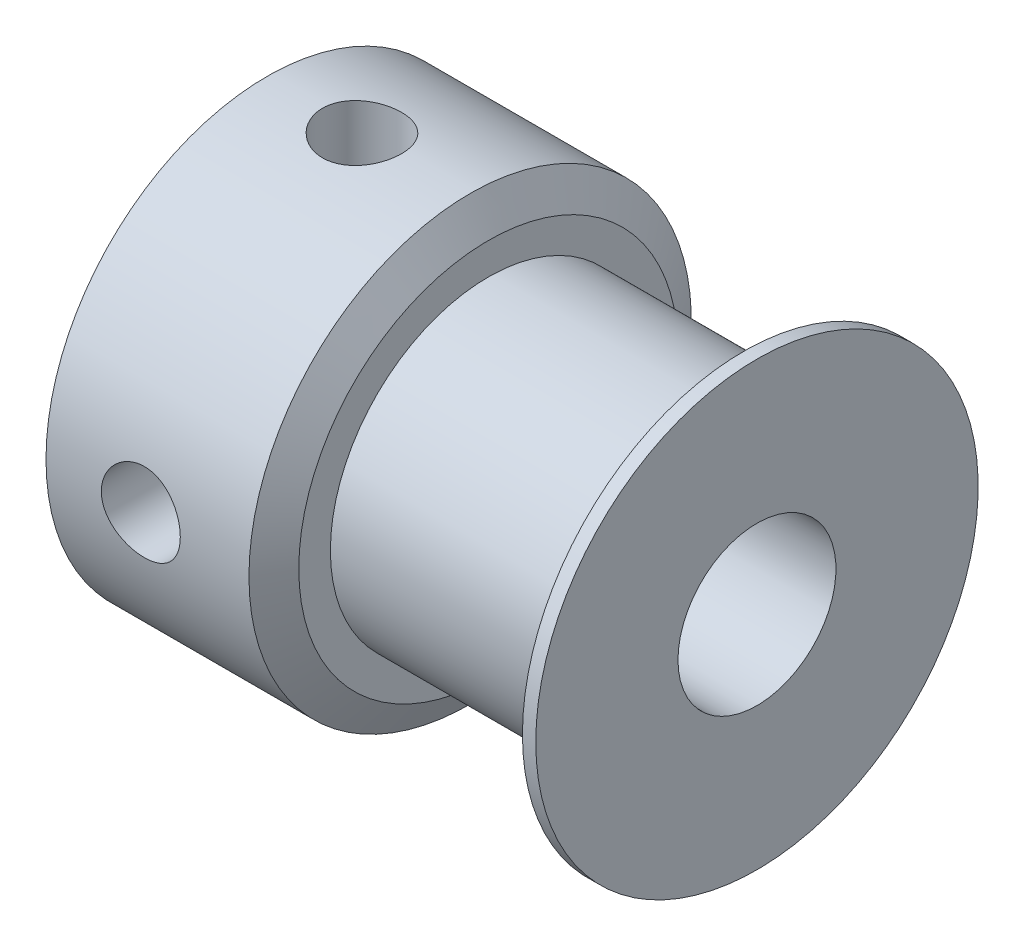
from build123d import *

# Parameters (mm, degrees)
ESQUISSE2_W = 1.25
ESQUISSE2_H = 7
ESQUISSE5_W = 1.25
ESQUISSE5_H = 7


with BuildPart() as part:
    # Esquisse1 → Révolution1 (revolve)
    with BuildSketch(Plane.XY, mode=Mode.PRIVATE) as r_volution1_sk:
        Polygon((0, 2.5), (0, 7), (6.422649731, 7), (7, 6), (7, 5), (14.5, 5), (14.5, 6), (15.077350269, 7), (15.5, 7), (15.5, 2.5), align=None)
    revolve(r_volution1_sk.sketch.rotate(Axis((0, 0, 0), (1, 0, 0)), 90), axis=Axis((0, 0, 0), (1, 0, 0)))

    # Esquisse2 → Trou taraudé M31 (revolve, cut)
    with BuildSketch(Plane.YZ.offset(3)):
        with Locations((0.625, 3.5)):
            Rectangle(ESQUISSE2_W, ESQUISSE2_H)
    revolve(axis=Axis((3, 0, -6.35), (0, 0, 1)), mode=Mode.SUBTRACT)

    # Esquisse5 → Trou taraudé M32 (revolve, cut)
    with BuildSketch(Plane(origin=(3, 0, 0), x_dir=(0, 0, -1), z_dir=(1, 0, 0))):
        with Locations((0.625, 3.5)):
            Rectangle(ESQUISSE5_W, ESQUISSE5_H)
    revolve(axis=Axis((3, -6.35, 0), (0, 1, 0)), mode=Mode.SUBTRACT)


solid = part.part
